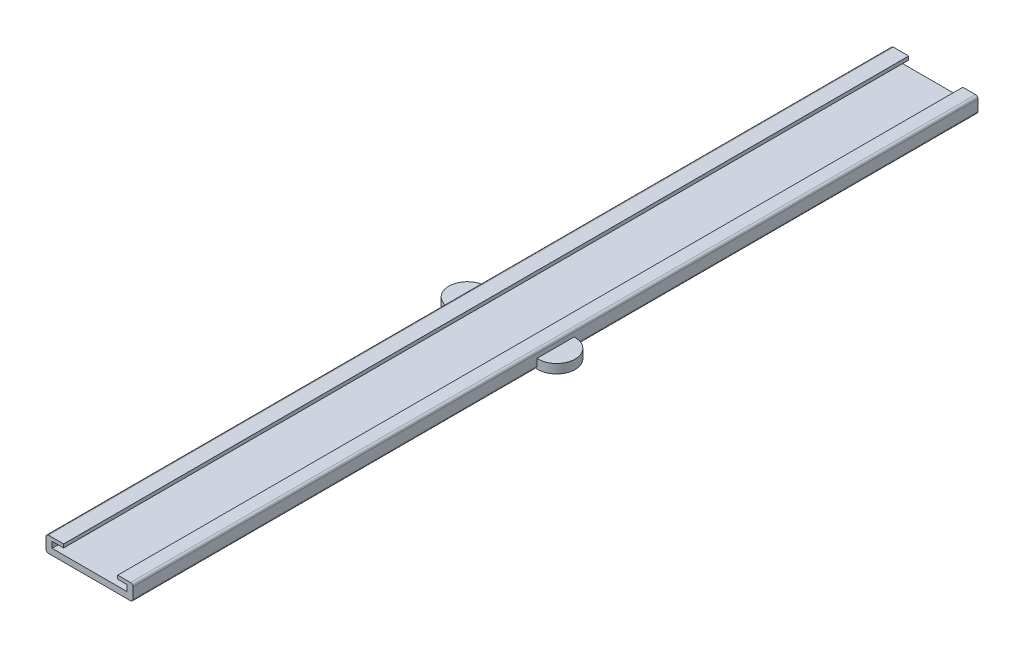
from build123d import *

# Parameters (mm, degrees)
BOSS_EXTRUDE1_DEPTH = 176.53
BOSS_EXTRUDE2_DEPTH = 1.905


with BuildPart() as part:
    # Sketch2 → Boss-Extrude1 (new body)
    with BuildSketch(Plane.XY):
        with BuildLine():
            Line((-8.5725, 0), (8.5725, 0))
            ThreePointArc((8.5725, 0), (8.931710245, 0.148789755), (9.0805, 0.508))
            Line((9.0805, 0.508), (9.0805, 2.794))
            ThreePointArc((9.0805, 2.794), (8.931710245, 3.153210245), (8.5725, 3.302))
            Line((8.5725, 3.302), (5.9055, 3.302))
            Line((5.9055, 3.302), (5.9055, 2.5654))
            Line((5.9055, 2.5654), (7.8105, 2.5654))
            Line((7.8105, 2.5654), (7.8105, 1.2954))
            Line((7.8105, 1.2954), (-7.8105, 1.2954))
            Line((-7.8105, 1.2954), (-7.8105, 2.5654))
            Line((-7.8105, 2.5654), (-5.3975, 2.5654))
            Line((-5.3975, 2.5654), (-5.3975, 3.302))
            Line((-5.3975, 3.302), (-8.5725, 3.302))
            ThreePointArc((-8.5725, 3.302), (-8.931710245, 3.153210245), (-9.0805, 2.794))
            Line((-9.0805, 2.794), (-9.0805, 0.508))
            ThreePointArc((-9.0805, 0.508), (-8.931710245, 0.148789755), (-8.5725, 0))
        make_face()
    extrude(amount=-BOSS_EXTRUDE1_DEPTH)

    # Sketch3 → Boss-Extrude2 (add)
    with BuildSketch(Plane(origin=(0, 0, 0), x_dir=(1, 0, 0), z_dir=(0, 1, 0))):
        with BuildLine():
            Line((8.5725, 84.455), (8.5725, 92.075))
            ThreePointArc((8.5725, 92.075), (13.193617406, 88.265), (8.5725, 84.455))
        make_face()
    boss_extrude2 = extrude(amount=BOSS_EXTRUDE2_DEPTH)

    # Mirror1: Boss-Extrude2 across plane
    add(boss_extrude2.mirror(Plane(origin=(0, 0, 0), x_dir=(0, 0, 1), z_dir=(1, 0, 0))))


solid = part.part
